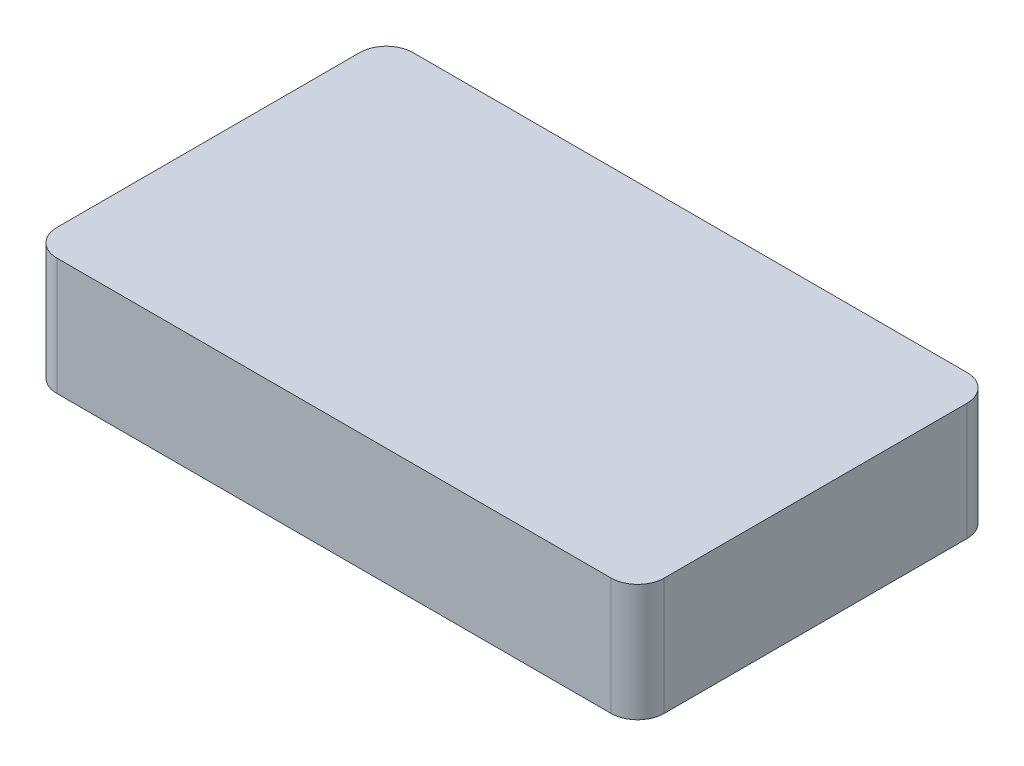
from build123d import *

# Parameters (mm, degrees)
BOSS_EXTRUDE1_DEPTH = 28


with BuildPart() as part:
    # Sketch1 → Boss-Extrude1 (new body)
    with BuildSketch(Plane(origin=(0, 0, 0), x_dir=(1, 0, 0), z_dir=(0, 1, 0))):
        with BuildLine():
            Line((-66.149999966, 42.500000037), (66.150000034, 42.500000037))
            ThreePointArc((66.150000034, 42.500000037), (70.640128095, 40.640128098), (72.500000034, 36.150000037))
            Line((72.500000034, 36.150000037), (72.500000034, -36.149999963))
            ThreePointArc((72.500000034, -36.149999963), (70.640128095, -40.640128024), (66.150000034, -42.499999963))
            Line((66.150000034, -42.499999963), (-66.149999966, -42.499999963))
            ThreePointArc((-66.149999966, -42.499999963), (-70.640128027, -40.640128024), (-72.499999966, -36.149999963))
            Line((-72.499999966, -36.149999963), (-72.499999966, 36.150000037))
            ThreePointArc((-72.499999966, 36.150000037), (-70.640128027, 40.640128098), (-66.149999966, 42.500000037))
        make_face()
    extrude(amount=BOSS_EXTRUDE1_DEPTH)


solid = part.part
